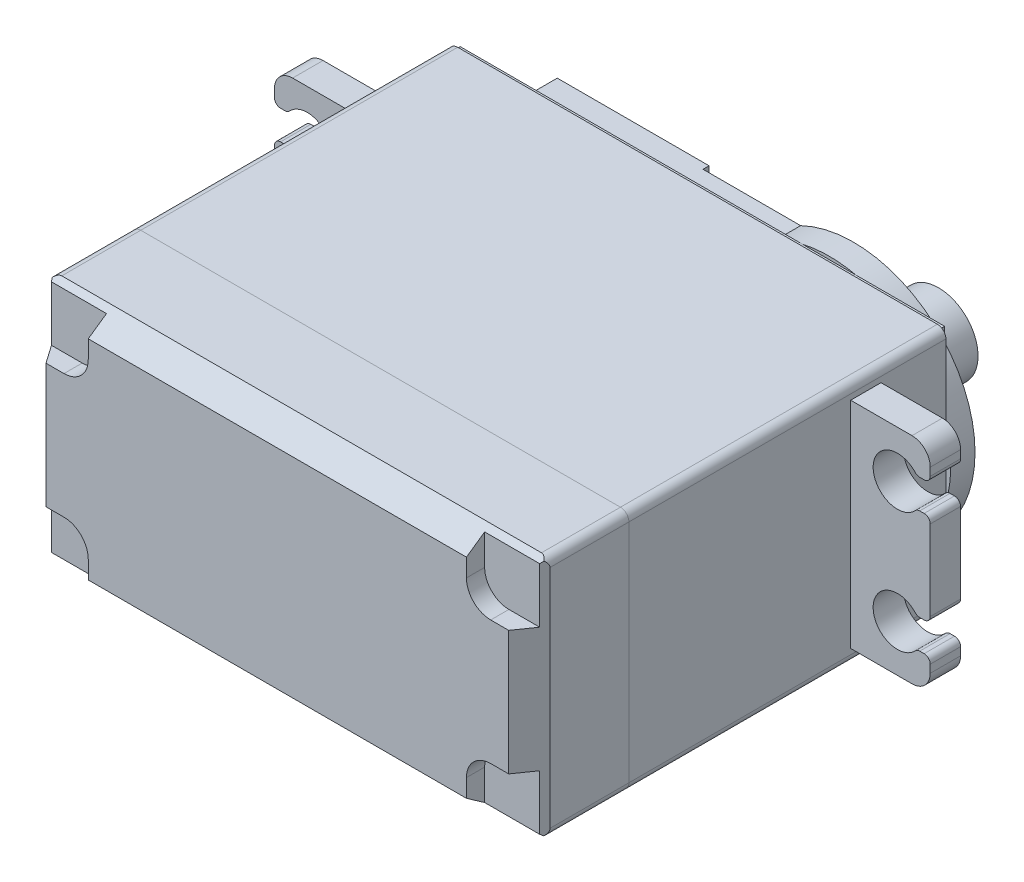
from build123d import *
from OCP.BRepFilletAPI import BRepFilletAPI_MakeChamfer

# Parameters (mm, degrees)
SKETCH1_W            = 40.9
SKETCH1_H            = 20
BOSS_EXTRUDE1_DEPTH  = 19.3
SKETCH3_W            = 40.9
SKETCH3_H            = 20
BOSS_EXTRUDE2_DEPTH  = 6.8
SKETCH4_W            = 40.9
SKETCH4_H            = 20
BOSS_EXTRUDE3_DEPTH  = 8.5
CHAMFER1_SIZE        = 2
CHAMFER1_SIZE2       = 1.400415076
CUT_EXTRUDE1_DEPTH   = 1.5
SKETCH6_W            = 39.9
SKETCH6_H            = 19.5
BOSS_EXTRUDE4_DEPTH  = 0.4
BOSS_EXTRUDE5_DEPTH  = 2
SKETCH8_R            = 6.5
BOSS_EXTRUDE6_DEPTH  = 1.5
SKETCH9_R            = 5.5
BOSS_EXTRUDE8_DEPTH  = 0.5
SKETCH11_R           = 3.25
BOSS_EXTRUDE9_DEPTH  = 5
SKETCH12_W           = 10.5
SKETCH12_H           = 15.998933302
BOSS_EXTRUDE10_DEPTH = 0.5
FILLET1_R            = 0.7
FILLET2_R            = 0.7
FILLET3_R            = 0.7
BOSS_EXTRUDE11_START = -5.74
BOSS_EXTRUDE11_DEPTH = 2.5


with BuildPart() as part:
    # Sketch1 → Boss-Extrude1 (new body)
    with BuildSketch(Plane.XY):
        Rectangle(SKETCH1_W, SKETCH1_H)
    extrude(amount=BOSS_EXTRUDE1_DEPTH)

    # Fillet1
    fillet1_edges = [part.edges().sort_by_distance(p)[0] for p in [
        (-20.45, 10, 9.65),
        (20.45, 10, 9.65),
        (20.45, -10, 9.65),
        (-20.45, -10, 9.65),
    ]]
    fillet(fillet1_edges, radius=FILLET1_R)



with BuildPart() as body_2:
    # Sketch3 → Boss-Extrude2 (new body)
    with BuildSketch(Plane(origin=(0, 0, 0), x_dir=(-1, 0, 0), z_dir=(0, 0, -1))):
        Rectangle(SKETCH3_W, SKETCH3_H)
    extrude(amount=BOSS_EXTRUDE2_DEPTH)

    # Sketch6 → Boss-Extrude4 (add)
    with BuildSketch(Plane(origin=(0, 0, -6.8), x_dir=(-1, 0, 0), z_dir=(0, 0, -1))):
        Rectangle(SKETCH6_W, SKETCH6_H)
    extrude(amount=BOSS_EXTRUDE4_DEPTH)

    # Sketch7 → Boss-Extrude5 (add)
    with BuildSketch(Plane(origin=(0, 0, -7.2), x_dir=(-1, 0, 0), z_dir=(0, 0, -1))):
        with BuildLine():
            Line((-6.09, 8.999466651), (14.45, 8.999466651))
            Line((14.45, 8.999466651), (14.45, 3))
            ThreePointArc((14.45, 3), (17.45, 0), (14.45, -3))
            Line((14.45, -3), (14.45, -8.999466651))
            Line((14.45, -8.999466651), (-6.09, -8.999466651))
            ThreePointArc((-6.09, -8.999466651), (-20.45, 0), (-6.09, 8.999466651))
        make_face()
    extrude(amount=BOSS_EXTRUDE5_DEPTH)

    # Sketch8 → Boss-Extrude6 (add)
    with BuildSketch(Plane(origin=(0, 0, -9.2), x_dir=(-1, 0, 0), z_dir=(0, 0, -1))):
        with Locations((-10.45, 0)):
            Circle(SKETCH8_R)
    extrude(amount=BOSS_EXTRUDE6_DEPTH)

    # Sketch9 → Boss-Extrude8 (add)
    with BuildSketch(Plane(origin=(0, 0, -10.7), x_dir=(-1, 0, 0), z_dir=(0, 0, -1))):
        with Locations((-10.45, 0)):
            Circle(SKETCH9_R)
    extrude(amount=BOSS_EXTRUDE8_DEPTH)

    # Sketch11 → Boss-Extrude9 (add)
    with BuildSketch(Plane(origin=(0, 0, -11.2), x_dir=(-1, 0, 0), z_dir=(0, 0, -1))):
        with Locations((-10.45, 0)):
            Circle(SKETCH11_R)
    extrude(amount=BOSS_EXTRUDE9_DEPTH)

    # Sketch12 → Boss-Extrude10 (add)
    with BuildSketch(Plane(origin=(0, 0, -9.2), x_dir=(-1, 0, 0), z_dir=(0, 0, -1))):
        with BuildLine():
            Line((14.45, 8.999466651), (1.95, 8.999466651))
            Line((1.95, 8.999466651), (1.95, 1.75))
            ThreePointArc((1.95, 1.75), (0.2, 0), (1.95, -1.75))
            Line((1.95, -1.75), (1.95, -8.999466651))
            Line((1.95, -8.999466651), (14.45, -8.999466651))
            Line((14.45, -8.999466651), (14.45, 8.999466651))
        make_face()
        with Locations((8.2, 0)):
            Rectangle(SKETCH12_W, SKETCH12_H, mode=Mode.SUBTRACT)
    extrude(amount=BOSS_EXTRUDE10_DEPTH)

    # Fillet2
    fillet2_edges = [body_2.edges().sort_by_distance(p)[0] for p in [
        (20.45, -10, -3.4),
        (20.45, 10, -3.4),
        (-20.45, 10, -3.4),
        (-20.45, -10, -3.4),
    ]]
    fillet(fillet2_edges, radius=FILLET2_R)


with BuildPart() as body_3:
    # Sketch4 → Boss-Extrude3 (new body)
    with BuildSketch(Plane.XY.offset(19.3)):
        Rectangle(SKETCH4_W, SKETCH4_H)
    extrude(amount=BOSS_EXTRUDE3_DEPTH)

    # Chamfer1: one chamfer whose edges measure the first distance from different faces: ONE call of the kernel's chamfer builder (chamfer() names one face for all edges)
    chamfer1_edges_1 = [body_3.edges().sort_by_distance(p)[0] for p in [
        (0, -10, 27.8),
    ]]
    chamfer1_side_1 = [body_3.faces().sort_by_distance(p)[0] for p in [
        (0, -10, 23.55),
    ]]
    chamfer1_edges_2 = [body_3.edges().sort_by_distance(p)[0] for p in [
        (20.45, 0, 27.8),
    ]]
    chamfer1_side_2 = [body_3.faces().sort_by_distance(p)[0] for p in [
        (20.45, 0, 23.55),
    ]]
    chamfer1_edges_3 = [body_3.edges().sort_by_distance(p)[0] for p in [
        (0, 10, 27.8),
    ]]
    chamfer1_side_3 = [body_3.faces().sort_by_distance(p)[0] for p in [
        (0, 10, 23.55),
    ]]
    chamfer1_edges_4 = [body_3.edges().sort_by_distance(p)[0] for p in [
        (-20.45, 0, 27.8),
    ]]
    chamfer1_side_4 = [body_3.faces().sort_by_distance(p)[0] for p in [
        (-20.45, 0, 23.55),
    ]]
    chamfer1 = BRepFilletAPI_MakeChamfer(body_3.part.solid().wrapped)
    for e in chamfer1_edges_1:
        chamfer1.Add(CHAMFER1_SIZE, CHAMFER1_SIZE2, e.wrapped, chamfer1_side_1[0].wrapped)  # the first distance lies on this face
    for e in chamfer1_edges_2:
        chamfer1.Add(CHAMFER1_SIZE, CHAMFER1_SIZE2, e.wrapped, chamfer1_side_2[0].wrapped)  # the first distance lies on this face
    for e in chamfer1_edges_3:
        chamfer1.Add(CHAMFER1_SIZE, CHAMFER1_SIZE2, e.wrapped, chamfer1_side_3[0].wrapped)  # the first distance lies on this face
    for e in chamfer1_edges_4:
        chamfer1.Add(CHAMFER1_SIZE, CHAMFER1_SIZE2, e.wrapped, chamfer1_side_4[0].wrapped)  # the first distance lies on this face
    add(Compound.cast(chamfer1.Shape()), mode=Mode.REPLACE)

    # Sketch5 → Cut-Extrude1 (cut)
    with BuildSketch(Plane.XY.offset(27.8)):
        with BuildLine():
            Line((-20.45, 10), (-15.57, 10))
            Line((-15.57, 10), (-15.57, 7.12))
            ThreePointArc((-15.57, 7.12), (-16.155786438, 5.705786438), (-17.57, 5.12))
            Line((-17.57, 5.12), (-20.45, 5.12))
            Line((-20.45, 5.12), (-20.45, 10))
        make_face()
        with BuildLine():
            Line((20.45, 5.12), (17.57, 5.12))
            ThreePointArc((17.57, 5.12), (16.155786438, 5.705786438), (15.57, 7.12))
            Line((15.57, 7.12), (15.57, 10))
            Line((15.57, 10), (20.45, 10))
            Line((20.45, 10), (20.45, 5.12))
        make_face()
        with BuildLine():
            Line((-20.45, -5.12), (-17.57, -5.12))
            ThreePointArc((-17.57, -5.12), (-16.155786438, -5.705786438), (-15.57, -7.12))
            Line((-15.57, -7.12), (-15.57, -10))
            Line((-15.57, -10), (-20.45, -10))
            Line((-20.45, -10), (-20.45, -5.12))
        make_face()
        with BuildLine():
            Line((20.45, -10), (20.45, -5.12))
            Line((20.45, -5.12), (17.57, -5.12))
            ThreePointArc((17.57, -5.12), (16.155786438, -5.705786438), (15.57, -7.12))
            Line((15.57, -7.12), (15.57, -10))
            Line((15.57, -10), (20.45, -10))
        make_face()
    extrude(amount=-CUT_EXTRUDE1_DEPTH, mode=Mode.SUBTRACT)

    # Fillet3
    fillet3_edges = [body_3.edges().sort_by_distance(p)[0] for p in [
        (20.45, 10, 22.55),
        (20.45, -10, 22.55),
        (-20.45, -10, 22.55),
        (-20.45, 10, 22.55),
    ]]
    fillet(fillet3_edges, radius=FILLET3_R)


with BuildPart() as part_1:
    add(part.part)

    add(body_2.part)  # Boss-Extrude11 merges body 2
    # Sketch13 → Boss-Extrude11 (add)
    with BuildSketch(Plane(origin=(0, 0, -7.2), x_dir=(-1, 0, 0), z_dir=(0, 0, -1)).offset(BOSS_EXTRUDE11_START)):
        with BuildLine():
            Line((20.45, 8.85), (25.5, 8.85))
            ThreePointArc((25.5, 8.85), (26.560660172, 8.410660172), (27, 7.35))
            Line((27, 7.35), (27, 6.7))
            ThreePointArc((27, 6.7), (26.853553391, 6.346446609), (26.5, 6.2))
            Line((26.5, 6.2), (26.133030278, 6.2))
            ThreePointArc((26.133030278, 6.2), (25.933030278, 6.241742431), (25.766424222, 6.36))
            ThreePointArc((25.766424222, 6.36), (22.3, 5), (25.766424222, 3.64))
            ThreePointArc((25.766424222, 3.64), (25.933030278, 3.758257569), (26.133030278, 3.8))
            Line((26.133030278, 3.8), (26.5, 3.8))
            ThreePointArc((26.5, 3.8), (26.853553391, 3.653553391), (27, 3.3))
            Line((27, 3.3), (27, -3.3))
            ThreePointArc((27, -3.3), (26.853553391, -3.653553391), (26.5, -3.8))
            Line((26.5, -3.8), (26.133030278, -3.8))
            ThreePointArc((26.133030278, -3.8), (25.933030278, -3.758257569), (25.766424222, -3.64))
            ThreePointArc((25.766424222, -3.64), (22.3, -5), (25.766424222, -6.36))
            ThreePointArc((25.766424222, -6.36), (25.933030278, -6.241742431), (26.133030278, -6.2))
            Line((26.133030278, -6.2), (26.5, -6.2))
            ThreePointArc((26.5, -6.2), (26.853553391, -6.346446609), (27, -6.7))
            Line((27, -6.7), (27, -7.35))
            ThreePointArc((27, -7.35), (26.560660172, -8.410660172), (25.5, -8.85))
            Line((25.5, -8.85), (20.45, -8.85))
            Line((20.45, -8.85), (20.45, 8.85))
        make_face()
    boss_extrude11 = extrude(amount=-BOSS_EXTRUDE11_DEPTH)

    # Mirror1: Boss-Extrude11 across plane
    add(boss_extrude11.mirror(Plane(origin=(0, 0, 0), x_dir=(0, 0, 1), z_dir=(1, 0, 0))))


solid = Compound([body_3.part, part_1.part])
